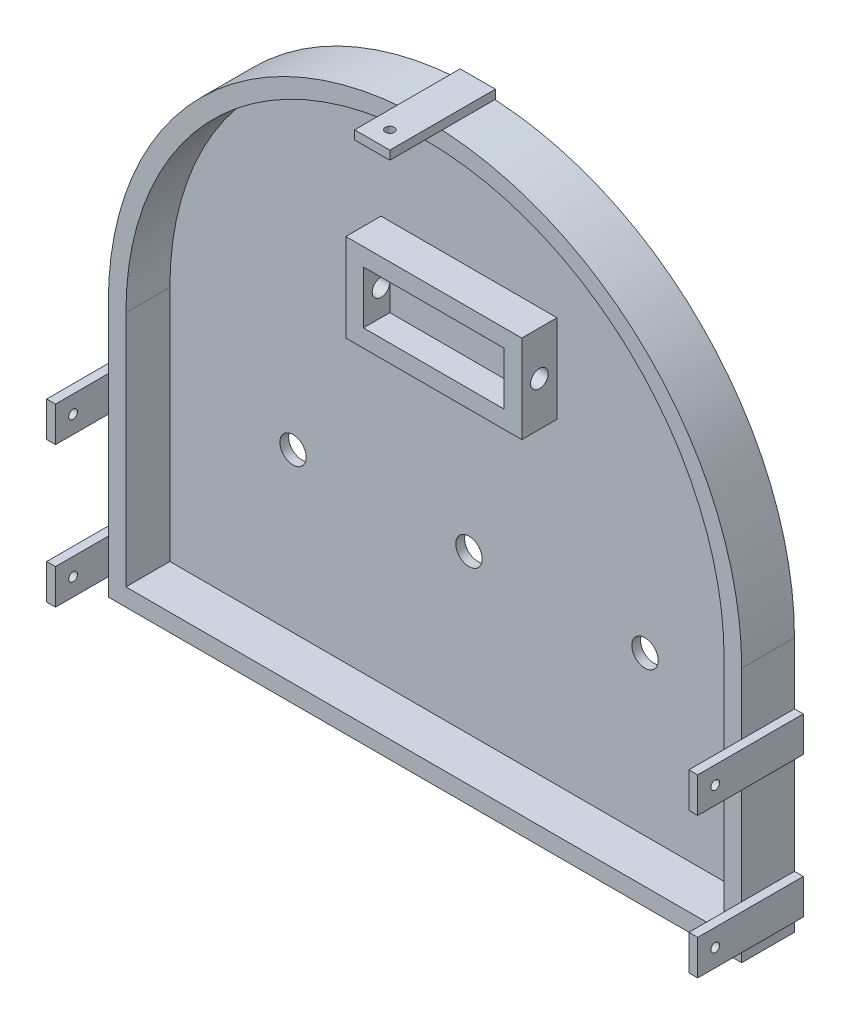
from build123d import *

# Parameters (mm, degrees)
BOSS_EXTRUDE1_DEPTH     = 5
BOSS_EXTRUDE2_DEPTH     = 30
SKETCH4_W               = 100
SKETCH4_H               = 50
BOSS_EXTRUDE3_DEPTH     = 20
SHELL1_T                = -10
SKETCH5_R               = 5
CUT_EXTRUDE1_DEPTH      = 20
SKETCH6_W               = 60
SKETCH6_H               = 20
SKETCH6_R               = 2.5
BOSS_EXTRUDE4_DEPTH     = 5
SKETCH8_W               = 20
SKETCH8_H               = 60
SKETCH8_R               = 2.5
BOSS_EXTRUDE5_DEPTH     = 5
CUT_EXTRUDE2_DEPTH      = 269.421310629
CUT_EXTRUDE2_DEPTH_BACK = 269.421310629
SKETCH9_R               = 7.5


with BuildPart() as part:
    # Sketch1 → Boss-Extrude1 (new body)
    with BuildSketch(Plane.XY):
        with BuildLine():
            Line((-180, 0), (-180, -145))
            Line((-180, -145), (180, -145))
            Line((180, -145), (180, 0))
            ThreePointArc((180, 0), (0, 180), (-180, 0))
        make_face()
    extrude(amount=BOSS_EXTRUDE1_DEPTH)

    # Sketch3 → Boss-Extrude2 (add)
    with BuildSketch(Plane.XY):
        with BuildLine():
            Line((-180, 0), (-180, -145))
            Line((-180, -145), (180, -145))
            Line((180, -145), (180, 0))
            ThreePointArc((180, 0), (0, 180), (-180, 0))
        make_face()
        with BuildLine():
            Line((-170, 0), (-170, -135))
            Line((-170, -135), (170, -135))
            Line((170, -135), (170, 0))
            ThreePointArc((170, 0), (0, 170), (-170, 0))
        make_face(mode=Mode.SUBTRACT)
    extrude(amount=BOSS_EXTRUDE2_DEPTH)

    # Sketch4 → Boss-Extrude3 (add)
    with BuildSketch(Plane.XY.offset(5)):
        with Locations((0, 70)):
            Rectangle(SKETCH4_W, SKETCH4_H)
    extrude(amount=BOSS_EXTRUDE3_DEPTH)

    # Shell1
    shell1_openings = [part.faces().sort_by_distance(p)[0] for p in [
        (0, 70, 25),
    ]]
    offset(amount=SHELL1_T, openings=shell1_openings)

    # Sketch5 → Cut-Extrude1 (cut)
    with BuildSketch(Plane(origin=(50, 0, 0), x_dir=(0, 0, -1), z_dir=(1, 0, 0))):
        with Locations(Location((-15, 70, 0), (0, 0, 90))):
            Circle(SKETCH5_R)
    cut_extrude1 = extrude(amount=-CUT_EXTRUDE1_DEPTH, mode=Mode.SUBTRACT)

    # Mirror1: Cut-Extrude1 across plane
    add(cut_extrude1.mirror(Plane(origin=(0, 0, 0), x_dir=(0, 0, 1), z_dir=(1, 0, 0))), mode=Mode.SUBTRACT)

    # Sketch6 → Boss-Extrude4 (add)
    # profile 1 of 2: a face of its own
    with BuildSketch(Plane(origin=(180, 0, 0), x_dir=(0, 0, -1), z_dir=(1, 0, 0))):
        with Locations((-30, -125)):
            Rectangle(SKETCH6_W, SKETCH6_H)
        with Locations(Location((-50, -125, 0), (0, 0, 90))):
            Circle(SKETCH6_R, mode=Mode.SUBTRACT)
    # profile 2 of 2: a face of its own
    with BuildSketch(Plane(origin=(180, 0, 0), x_dir=(0, 0, -1), z_dir=(1, 0, 0))):
        with Locations((-30, -45)):
            Rectangle(SKETCH6_W, SKETCH6_H)
        with Locations(Location((-50, -45, 0), (0, 0, 270))):
            Circle(SKETCH6_R, mode=Mode.SUBTRACT)
    boss_extrude4 = extrude(amount=BOSS_EXTRUDE4_DEPTH)

    # Mirror2: Boss-Extrude4 across plane
    add(boss_extrude4.mirror(Plane(origin=(0, 0, 0), x_dir=(0, 0, 1), z_dir=(1, 0, 0))))

    # Sketch9 → Cut-Extrude2 (cut, two sides: drawn at the far end of the back side and taken through both)
    with BuildSketch(Plane(origin=(0, 0, 0), x_dir=(-1, 0, 0), z_dir=(0, 0, -1)).offset(-CUT_EXTRUDE2_DEPTH_BACK)):
        with Locations(Location((-100, -45, 0), (0, 0, 180))):
            Circle(SKETCH9_R)
        with Locations(Location((0, -45, 0), (0, 0, 180))):
            Circle(SKETCH9_R)
        with Locations(Location((100, -45, 0), (0, 0, 180))):
            Circle(SKETCH9_R)
    extrude(amount=CUT_EXTRUDE2_DEPTH + CUT_EXTRUDE2_DEPTH_BACK, mode=Mode.SUBTRACT)


with BuildPart() as body_2:
    # Sketch8 → Boss-Extrude5 (new body)
    with BuildSketch(Plane(origin=(0, 180, 0), x_dir=(1, 0, 0), z_dir=(0, 1, 0))):
        with Locations((0, -30)):
            Rectangle(SKETCH8_W, SKETCH8_H)
        with Locations(Location((0, -50, 0), (0, 0, 270))):
            Circle(SKETCH8_R, mode=Mode.SUBTRACT)
    extrude(amount=BOSS_EXTRUDE5_DEPTH)


solid = Compound([part.part, body_2.part])
